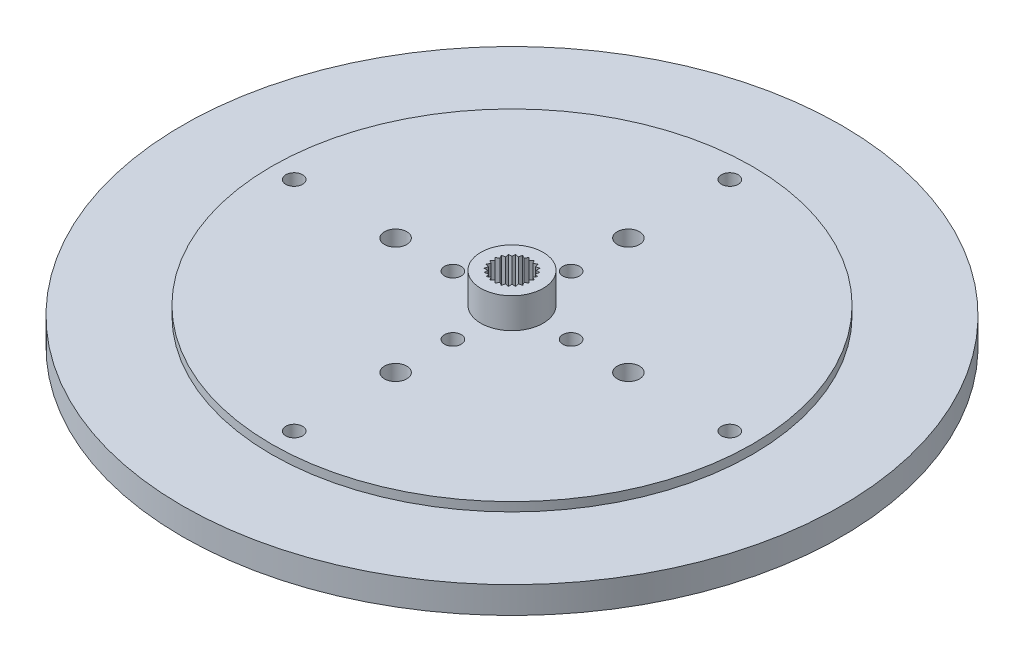
from build123d import *

# Parameters (mm, degrees)
SKETCH1_R         = 46.99
EXTRUDE1_DEPTH    = 3.81
SKETCH2_R         = 34.29
EXTRUDE2_DEPTH    = 1.27
SKETCH3_R         = 4.445
EXTRUDE3_DEPTH    = 4.318
SKETCH4_R         = 1.1811
EXTRUDE4_DEPTH    = 68.115144371
SKETCH5_R         = 1.1938
SKETCH5_R_2       = 1.5875
EXTRUDE5_DEPTH    = 67.647780158
CIRPATTERN1_COUNT = 4
SKETCH6_R         = 2.8321
EXTRUDE6_DEPTH    = 4.318
EXTRUDE7_DEPTH    = 4.318
CIRPATTERN2_COUNT = 24


with BuildPart() as part:
    # Sketch1 → Extrude1 (new body)
    with BuildSketch(Plane(origin=(0, 0, 0), x_dir=(1, 0, 0), z_dir=(0, 1, 0))):
        with Locations(Location((0, 0, 0), (0, 0, 90))):
            Circle(SKETCH1_R)
    extrude(amount=EXTRUDE1_DEPTH)

    # Sketch2 → Extrude2 (add)
    with BuildSketch(Plane(origin=(0, 3.81, 0), x_dir=(1, 0, 0), z_dir=(0, 1, 0))):
        with Locations(Location((0, 0, 0), (0, 0, 270))):
            Circle(SKETCH2_R)
    extrude(amount=EXTRUDE2_DEPTH)

    # Sketch3 → Extrude3 (add)
    with BuildSketch(Plane(origin=(0, 5.08, 0), x_dir=(1, 0, 0), z_dir=(0, 1, 0))):
        with Locations(Location((0, 0, 0), (0, 0, 270))):
            Circle(SKETCH3_R)
    extrude(amount=EXTRUDE3_DEPTH)

    # Sketch4 → Extrude4 (cut, through all)
    with BuildSketch(Plane(origin=(0, 9.398, 0), x_dir=(1, 0, 0), z_dir=(0, 1, 0))):
        with Locations(Location((0, 0, 0), (0, 0, 270))):
            Circle(SKETCH4_R)
    extrude(amount=-EXTRUDE4_DEPTH, mode=Mode.SUBTRACT)

    # Sketch5 → Extrude5 (cut, through all)
    with BuildSketch(Plane(origin=(0, 5.08, 0), x_dir=(1, 0, 0), z_dir=(0, 1, 0))):
        with Locations(Location((0, -8.42772, 0), (0, 0, 270))):
            Circle(SKETCH5_R)
        with Locations(Location((0, -16.59382, 0), (0, 0, 270))):
            Circle(SKETCH5_R_2)
        with Locations(Location((0, -31.05912, 0), (0, 0, 270))):
            Circle(SKETCH5_R)
    extrude5 = extrude(amount=-EXTRUDE5_DEPTH, mode=Mode.SUBTRACT)

    # CirPattern1: Extrude5 ×4 about axis
    cirpattern1_axis = Axis((0, 0, 0), (0, 1, 0))
    for i in range(1, CIRPATTERN1_COUNT):
        add(extrude5.rotate(cirpattern1_axis, i * 360 / CIRPATTERN1_COUNT), mode=Mode.SUBTRACT)

    # Sketch6 → Extrude6 (cut)
    with BuildSketch(Plane(origin=(0, 9.398, 0), x_dir=(1, 0, 0), z_dir=(0, 1, 0))):
        with Locations(Location((0, 0, 0), (0, 0, 270))):
            Circle(SKETCH6_R)
    extrude(amount=-EXTRUDE6_DEPTH, mode=Mode.SUBTRACT)

    # Sketch7 → Extrude7 (add)
    with BuildSketch(Plane(origin=(0, 9.398, 0), x_dir=(1, 0, 0), z_dir=(0, 1, 0))):
        Polygon((0, 2.4384), (0.369663229, 2.807870992), (0.369663229, 3.102932626), (-0.369663229, 3.102932626), (-0.369663229, 2.807870992), align=None)
    extrude7 = extrude(amount=-EXTRUDE7_DEPTH)

    # CirPattern2: Extrude7 ×24 about axis
    cirpattern2_axis = Axis((0, 0, 0), (0, 1, 0))
    for i in range(1, CIRPATTERN2_COUNT):
        add(extrude7.rotate(cirpattern2_axis, i * 360 / CIRPATTERN2_COUNT))


solid = part.part
